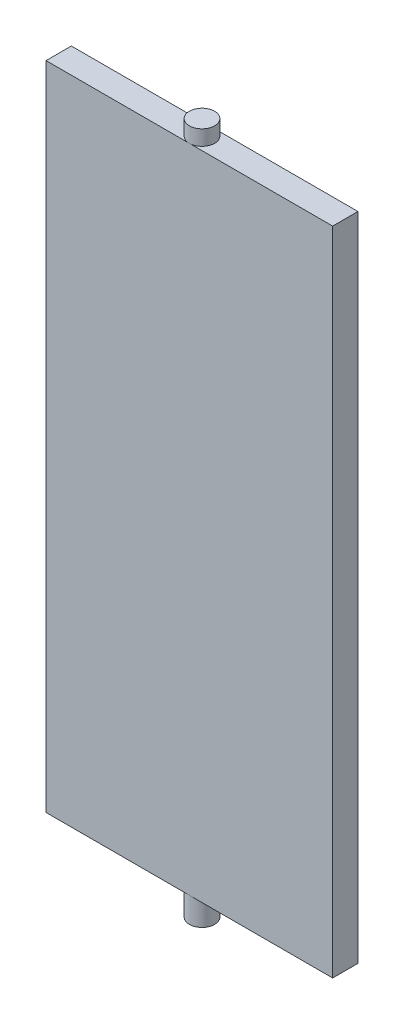
from build123d import *

# Parameters (mm, degrees)
SKETCH1_W           = 77.25
SKETCH1_H           = 34
BOSS_EXTRUDE1_DEPTH = 3
BOSS_EXTRUDE2_DEPTH = 1.8
BOSS_EXTRUDE3_START = -80.25
BOSS_EXTRUDE3_DEPTH = 3


with BuildPart() as part:
    # Sketch1 → Boss-Extrude1 (new body)
    with BuildSketch(Plane(origin=(0, 0, 0), x_dir=(0, 1, 0), z_dir=(0, 0, 1))):
        with Locations((38.625, 17)):
            Rectangle(SKETCH1_W, SKETCH1_H)
    extrude(amount=BOSS_EXTRUDE1_DEPTH)

    # Sketch2 → Boss-Extrude2 (add)
    with BuildSketch(Plane(origin=(0, 77.25, 0), x_dir=(-1, 0, 0), z_dir=(0, 1, 0))):
        with BuildLine():
            ThreePointArc((18.5, 1.5), (18.060660172, 2.560660172), (17, 3))
            Line((17, 3), (17, 0))
            ThreePointArc((17, 0), (18.060660172, 0.439339828), (18.5, 1.5))
        make_face()
        with BuildLine():
            Line((17, 0), (17, 3))
            ThreePointArc((17, 3), (15.5, 1.5), (17, 0))
        make_face()
    extrude(amount=BOSS_EXTRUDE2_DEPTH)

    # Sketch2<4> → Boss-Extrude3 (add)
    with BuildSketch(Plane(origin=(0, 77.25, 0), x_dir=(-1, 0, 0), z_dir=(0, 1, 0)).offset(BOSS_EXTRUDE3_START)):
        with BuildLine():
            ThreePointArc((18.5, 1.5), (18.060660172, 2.560660172), (17, 3))
            Line((17, 3), (17, 0))
            ThreePointArc((17, 0), (18.060660172, 0.439339828), (18.5, 1.5))
        make_face()
        with BuildLine():
            Line((17, 0), (17, 3))
            ThreePointArc((17, 3), (15.5, 1.5), (17, 0))
        make_face()
    extrude(amount=BOSS_EXTRUDE3_DEPTH)


solid = part.part
